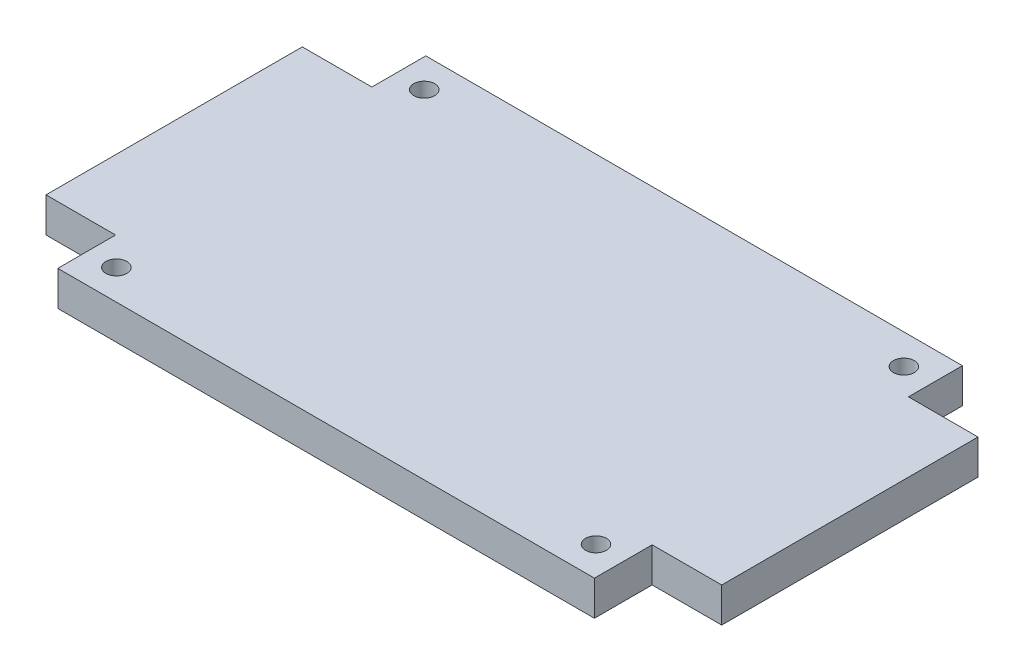
from build123d import *

# Parameters (mm, degrees)
SKETCH_1_W      = 77.14
SKETCH_1_H      = 52.9
SKETCH_1_R      = 1.5
EXTRUDE_1_DEPTH = 5
SKETCH_2_W      = 36.844868946
SKETCH_2_H      = 5
EXTRUDE_2_DEPTH = 10


with BuildPart() as part:
    # 草图1 → 凸台-拉伸1 (new body)
    with BuildSketch(Plane(origin=(0, 0, 0), x_dir=(1, 0, 0), z_dir=(0, 1, 0))):
        Rectangle(SKETCH_1_W, SKETCH_1_H)
        with Locations(Location((34.475, -22.13, 0), (0, 0, 270))):
            Circle(SKETCH_1_R, mode=Mode.SUBTRACT)
        with Locations(Location((34.475, 22.13, 0), (0, 0, 270))):
            Circle(SKETCH_1_R, mode=Mode.SUBTRACT)
        with Locations(Location((-34.475, 22.13, 0), (0, 0, 270))):
            Circle(SKETCH_1_R, mode=Mode.SUBTRACT)
        with Locations(Location((-34.475, -22.13, 0), (0, 0, 270))):
            Circle(SKETCH_1_R, mode=Mode.SUBTRACT)
    extrude(amount=EXTRUDE_1_DEPTH)

    # 草图2 → 凸台-拉伸2 (add)
    with BuildSketch(Plane.ZY.offset(38.57)):
        with Locations((-0.272252726, 2.5)):
            Rectangle(SKETCH_2_W, SKETCH_2_H)
    extrude_2 = extrude(amount=EXTRUDE_2_DEPTH)

    # 镜向1: 凸台-拉伸2 across plane
    add(extrude_2.mirror(Plane(origin=(0, 0, 0), x_dir=(0, 0, 1), z_dir=(1, 0, 0))))


solid = part.part
